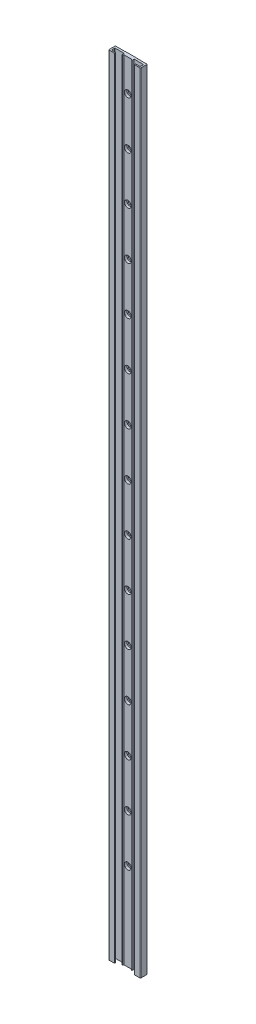
from build123d import *

# Parameters (mm, degrees)
ESQUISSE1_W                                        = 40
ESQUISSE1_H                                        = 990
BOSS_EXTRU_1_DEPTH                                 = 8.7
ENL_V_MAT_EXTRU_1_DEPTH                            = 991.240218331
ESQUISSE3_W                                        = 12
ESQUISSE3_H                                        = 0.2
ENL_V_MAT_EXTRU_2_DEPTH                            = 991.240218331
ESQUISSE4_W                                        = 12
ESQUISSE4_H                                        = 0.2
ENL_V_MAT_EXTRU_3_DEPTH                            = 991.240218331
CHAMBRAGE_POUR_VIS_T_TE_HEXAGONALE_M41_D           = 4.5
CHAMBRAGE_POUR_VIS_T_TE_HEXAGONALE_M41_CBORE_D     = 8.5
CHAMBRAGE_POUR_VIS_T_TE_HEXAGONALE_M41_CBORE_DEPTH = 3.1
CONG_1_R                                           = 0.5
CONG_2_R                                           = 1
R_P_TITION_LIN_AIRE1_COUNT                         = 13
R_P_TITION_LIN_AIRE1_PITCH                         = 60


with BuildPart() as part:
    # Esquisse1 → Boss.-Extru.1 (new body)
    with BuildSketch(Plane.XY.offset(8.7)):
        with Locations((0, -295)):
            Rectangle(ESQUISSE1_W, ESQUISSE1_H)
    extrude(amount=-BOSS_EXTRU_1_DEPTH)

    # Esquisse2 → Enlèv. mat.-Extru.1 (cut, through all)
    with BuildSketch(Plane(origin=(0, 200, 0), x_dir=(-1, 0, 0), z_dir=(0, 1, 0))):
        Polygon((12.5, 8.7), (-12.5, 8.7), (-12.5, 7.2), (-18, 7.2), (-18, 2.8), (-6.3, 2.8), (-6.3, 5.5), (-5.75, 5.5), (-4.75, 4.5), (4.75, 4.5), (5.75, 5.5), (6.3, 5.5), (6.3, 2.8), (18, 2.8), (18, 7.2), (12.5, 7.2), align=None)
    extrude(amount=-ENL_V_MAT_EXTRU_1_DEPTH, mode=Mode.SUBTRACT)

    # Esquisse3 → Enlèv. mat.-Extru.2 (cut, through all)
    with BuildSketch(Plane(origin=(0, 200, 0), x_dir=(-1, 0, 0), z_dir=(0, 1, 0))):
        with Locations((14, 0.1)):
            Rectangle(ESQUISSE3_W, ESQUISSE3_H)
    extrude(amount=-ENL_V_MAT_EXTRU_2_DEPTH, mode=Mode.SUBTRACT)

    # Esquisse4 → Enlèv. mat.-Extru.3 (cut, through all)
    with BuildSketch(Plane(origin=(0, 200, 0), x_dir=(-1, 0, 0), z_dir=(0, 1, 0))):
        with Locations((-14, 0.1)):
            Rectangle(ESQUISSE4_W, ESQUISSE4_H)
    extrude(amount=-ENL_V_MAT_EXTRU_3_DEPTH, mode=Mode.SUBTRACT)

    # Chambrage pour vis à tête hexagonale M41 (through all)
    with Locations(Plane.XY.offset(4.5)):
        with Locations((0, 40), (0, 100), (0, 160)):
            chambrage_pour_vis_t_te_hexagonale_m41 = CounterBoreHole(CHAMBRAGE_POUR_VIS_T_TE_HEXAGONALE_M41_D / 2, CHAMBRAGE_POUR_VIS_T_TE_HEXAGONALE_M41_CBORE_D / 2, CHAMBRAGE_POUR_VIS_T_TE_HEXAGONALE_M41_CBORE_DEPTH)

    # Congé1
    cong_1_edges = [part.edges().sort_by_distance(p)[0] for p in [
        (-18, -295, 7.2),
        (-18, -295, 2.8),
        (18, -295, 2.8),
        (18, -295, 7.2),
        (-20, -295, 0.2),
        (20, -295, 0.2),
    ]]
    fillet(cong_1_edges, radius=CONG_1_R)

    # Congé2
    cong_2_edges = [part.edges().sort_by_distance(p)[0] for p in [
        (-20, -295, 8.7),
        (20, -295, 8.7),
    ]]
    fillet(cong_2_edges, radius=CONG_2_R)

    # Répétition linéaire1: Chambrage pour vis à tête hexagonale M41 ×13
    with Locations(*[(0, -i * R_P_TITION_LIN_AIRE1_PITCH, 0) for i in range(1, R_P_TITION_LIN_AIRE1_COUNT)]):
        add(chambrage_pour_vis_t_te_hexagonale_m41, mode=Mode.SUBTRACT)


solid = part.part
